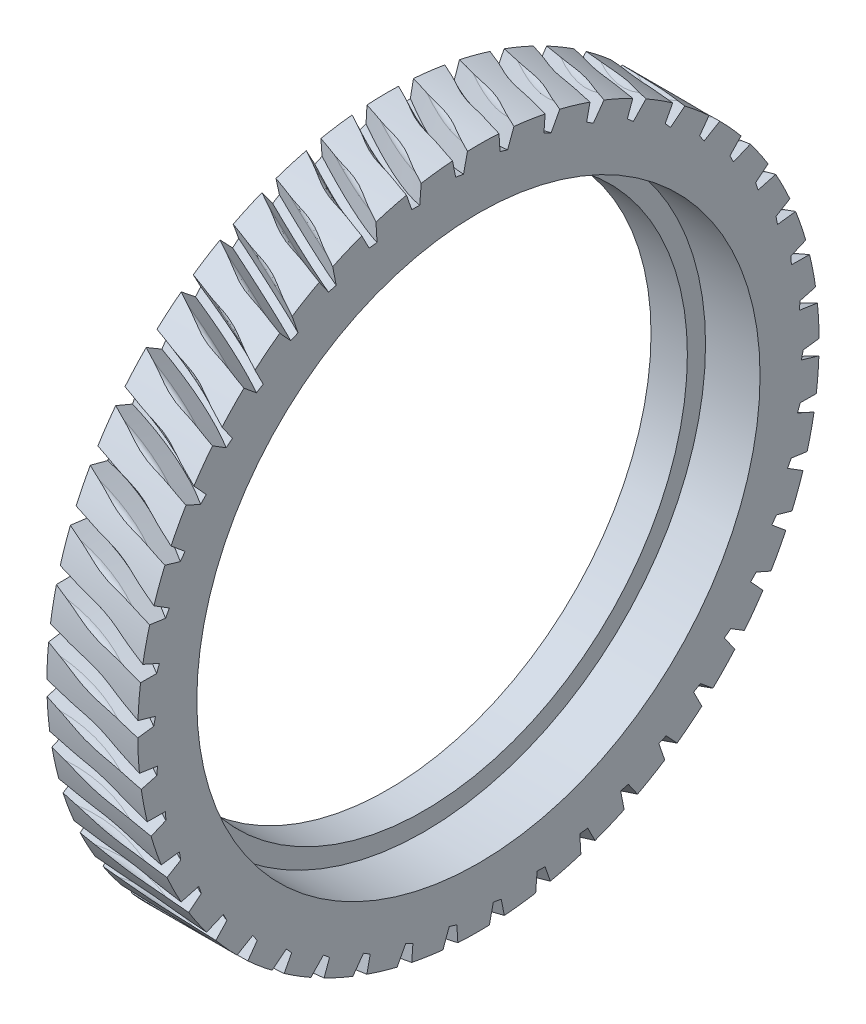
from build123d import *

# Parameters (mm, degrees)
R_P_TITION_CIRCULAIRE1_COUNT = 46


with BuildPart() as part:
    # Esquisse1 → Base-Révolution (revolve)
    with BuildSketch(Plane.XY, mode=Mode.PRIVATE) as base_r_volution_sk:
        Polygon((0, 31), (0, 37.5), (-10, 37.5), (-10, 29), (-6, 29), (-6, 31), align=None)
    revolve(base_r_volution_sk.sketch.rotate(Axis((0, 0, 0), (1, 0, 0)), 90), axis=Axis((0, 0, 0), (1, 0, 0)))

    # Esquisse4 → Enlever de la matière-Révolution1 (revolve, cut)
    with BuildSketch(Plane(origin=(-4.267766953, 0, -1.767766953), x_dir=(-0.3826834323650815, 0, 0.9238795325112903), z_dir=(-0.9238795325112903, 0, -0.3826834323650815))):
        with BuildLine():
            Line((1.001599732, 36.907911691), (1.513417162, 34.5))
            Line((1.513417162, 34.5), (2.313417162, 34.5))
            Line((2.313417162, 34.5), (2.825234592, 36.907911691))
            ThreePointArc((2.825234592, 36.907911691), (3.174061801, 37.477145961), (3.803382192, 37.7))
            Line((3.803382192, 37.7), (8.1, 37.7))
            Line((8.1, 37.7), (8.1, 39.7))
            Line((8.1, 39.7), (-3.9, 39.7))
            Line((-3.9, 39.7), (-3.9, 37.7))
            Line((-3.9, 37.7), (0.023452131, 37.7))
            ThreePointArc((0.023452131, 37.7), (0.652772522, 37.477145961), (1.001599732, 36.907911691))
        make_face()
    enlever_de_la_mati_re_r_volution1 = revolve(axis=Axis((1.051532757, 48.5, -14.609692455), (-0.38268343236508157, 0, 0.9238795325112902)), mode=Mode.SUBTRACT)

    # Répétition circulaire1: Enlever de la matière-Révolution1 ×46 about axis
    r_p_tition_circulaire1_axis = Axis((0, 0, 0), (1, 0, 0))
    for i in range(1, R_P_TITION_CIRCULAIRE1_COUNT):
        add(enlever_de_la_mati_re_r_volution1.rotate(r_p_tition_circulaire1_axis, i * 360 / R_P_TITION_CIRCULAIRE1_COUNT), mode=Mode.SUBTRACT)


solid = part.part
